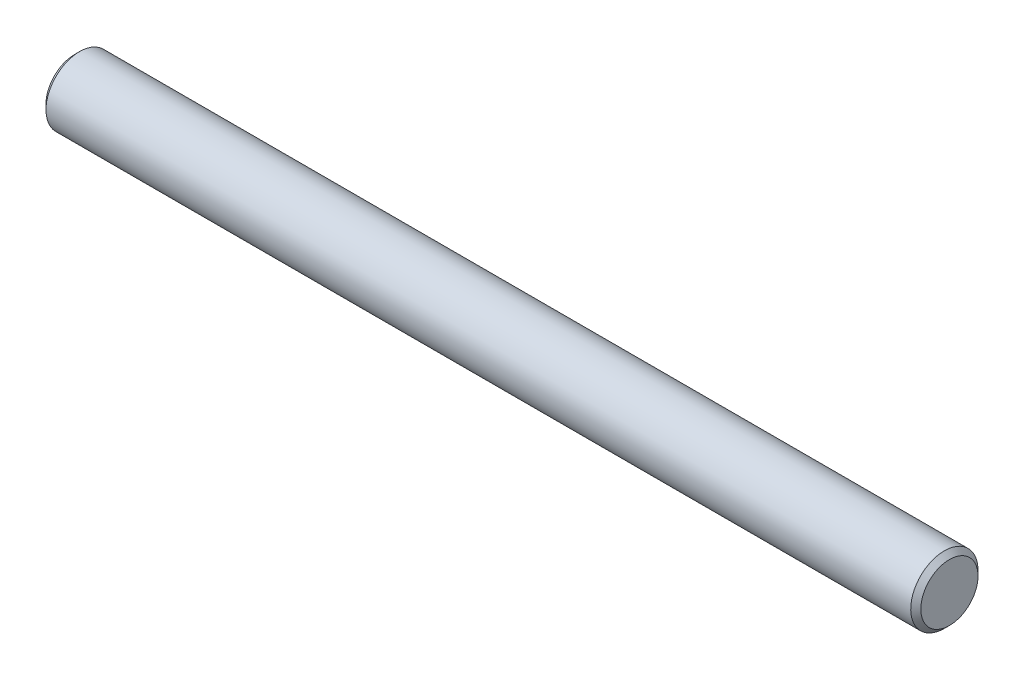
from build123d import *


with BuildPart() as part:
    # Esquisse1 → Révolution1 (revolve)
    with BuildSketch(Plane.XY):
        Polygon((0, 0), (-52, 0), (-52, 1.7), (-51.7, 2), (-0.3, 2), (0, 1.7), align=None)
    revolve(axis=Axis((0, 0, 0), (-1, 0, 0)))


solid = part.part
